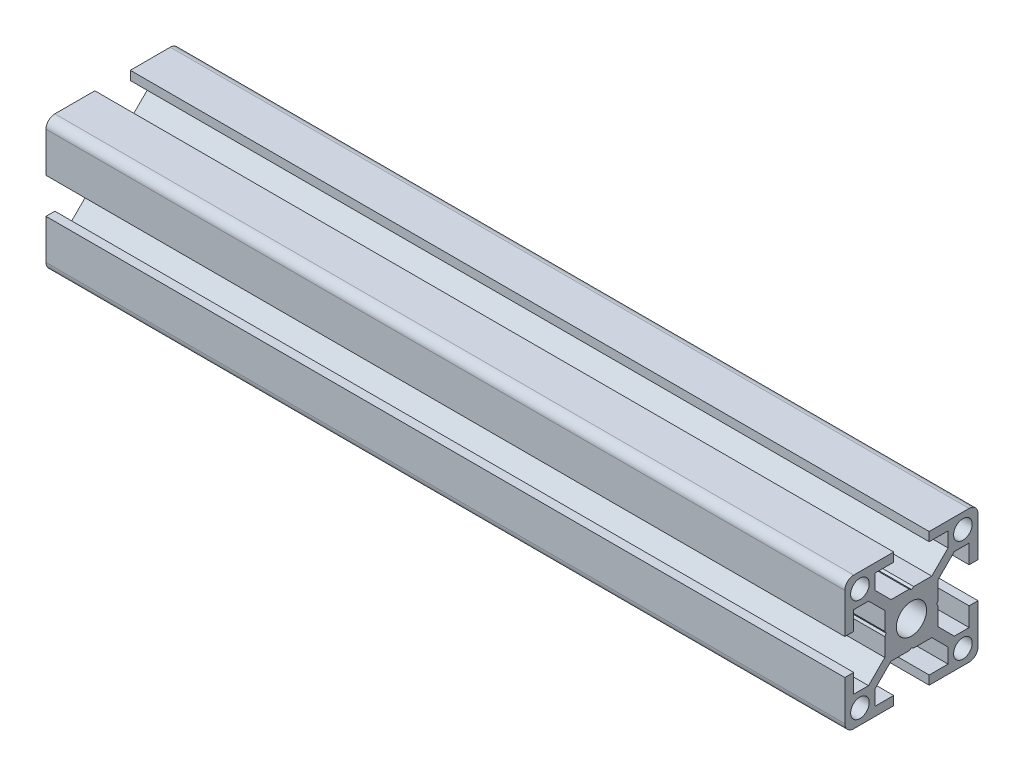
from build123d import *

# Parameters (mm, degrees)
SKETCH1_R           = 3.4
SKETCH1_R_2         = 2.1
BOSS_EXTRUDE1_DEPTH = 180


with BuildPart() as part:
    # Sketch1 → Boss-Extrude1 (new body)
    with BuildSketch(Plane(origin=(0, 0, 0), x_dir=(0, -1, 0), z_dir=(-1, 0, 0))):
        with BuildLine():
            Line((13, -4), (13, -8.25))
            Line((13, -8.25), (9.664213562, -8.25))
            Line((9.664213562, -8.25), (6, -4.585786438))
            Line((6, -4.585786438), (6, -0.519615242))
            Line((6, -0.519615242), (5.7, 0))
            Line((5.7, 0), (6, 0.519615242))
            Line((6, 0.519615242), (6, 4.585786438))
            Line((6, 4.585786438), (9.664213562, 8.25))
            Line((9.664213562, 8.25), (13, 8.25))
            Line((13, 8.25), (13, 4))
            Line((13, 4), (15, 4))
            Line((15, 4), (15, 13))
            ThreePointArc((15, 13), (14.414213562, 14.414213562), (13, 15))
            Line((13, 15), (4, 15))
            Line((4, 15), (4, 13))
            Line((4, 13), (8.25, 13))
            Line((8.25, 13), (8.25, 9.664213562))
            Line((8.25, 9.664213562), (4.585786438, 6))
            Line((4.585786438, 6), (0.519615242, 6))
            Line((0.519615242, 6), (0, 5.7))
            Line((0, 5.7), (-0.519615242, 6))
            Line((-0.519615242, 6), (-4.585786438, 6))
            Line((-4.585786438, 6), (-8.25, 9.664213562))
            Line((-8.25, 9.664213562), (-8.25, 13))
            Line((-8.25, 13), (-4, 13))
            Line((-4, 13), (-4, 15))
            Line((-4, 15), (-13, 15))
            ThreePointArc((-13, 15), (-14.414213562, 14.414213562), (-15, 13))
            Line((-15, 13), (-15, 4))
            Line((-15, 4), (-13, 4))
            Line((-13, 4), (-13, 8.25))
            Line((-13, 8.25), (-9.664213562, 8.25))
            Line((-9.664213562, 8.25), (-6, 4.585786438))
            Line((-6, 4.585786438), (-6, 0.519615242))
            Line((-6, 0.519615242), (-5.7, 0))
            Line((-5.7, 0), (-6, -0.519615242))
            Line((-6, -0.519615242), (-6, -4.585786438))
            Line((-6, -4.585786438), (-9.664213562, -8.25))
            Line((-9.664213562, -8.25), (-13, -8.25))
            Line((-13, -8.25), (-13, -4))
            Line((-13, -4), (-15, -4))
            Line((-15, -4), (-15, -13))
            ThreePointArc((-15, -13), (-14.414213562, -14.414213562), (-13, -15))
            Line((-13, -15), (-4, -15))
            Line((-4, -15), (-4, -13))
            Line((-4, -13), (-8.25, -13))
            Line((-8.25, -13), (-8.25, -9.664213562))
            Line((-8.25, -9.664213562), (-4.585786438, -6))
            Line((-4.585786438, -6), (-0.519615242, -6))
            Line((-0.519615242, -6), (0, -5.7))
            Line((0, -5.7), (0.519615242, -6))
            Line((0.519615242, -6), (4.585786438, -6))
            Line((4.585786438, -6), (8.25, -9.664213562))
            Line((8.25, -9.664213562), (8.25, -13))
            Line((8.25, -13), (4, -13))
            Line((4, -13), (4, -15))
            Line((4, -15), (13, -15))
            ThreePointArc((13, -15), (14.414213562, -14.414213562), (15, -13))
            Line((15, -13), (15, -4))
            Line((15, -4), (13, -4))
        make_face()
        with Locations(Location((0, 0, 0), (0, 0, 90))):
            Circle(SKETCH1_R, mode=Mode.SUBTRACT)
        with Locations(Location((11.6, -11.6, 0), (0, 0, 90))):
            Circle(SKETCH1_R_2, mode=Mode.SUBTRACT)
        with Locations(Location((11.6, 11.6, 0), (0, 0, 90))):
            Circle(SKETCH1_R_2, mode=Mode.SUBTRACT)
        with Locations(Location((-11.6, 11.6, 0), (0, 0, 90))):
            Circle(SKETCH1_R_2, mode=Mode.SUBTRACT)
        with Locations(Location((-11.6, -11.6, 0), (0, 0, 90))):
            Circle(SKETCH1_R_2, mode=Mode.SUBTRACT)
    extrude(amount=-BOSS_EXTRUDE1_DEPTH)


solid = part.part
